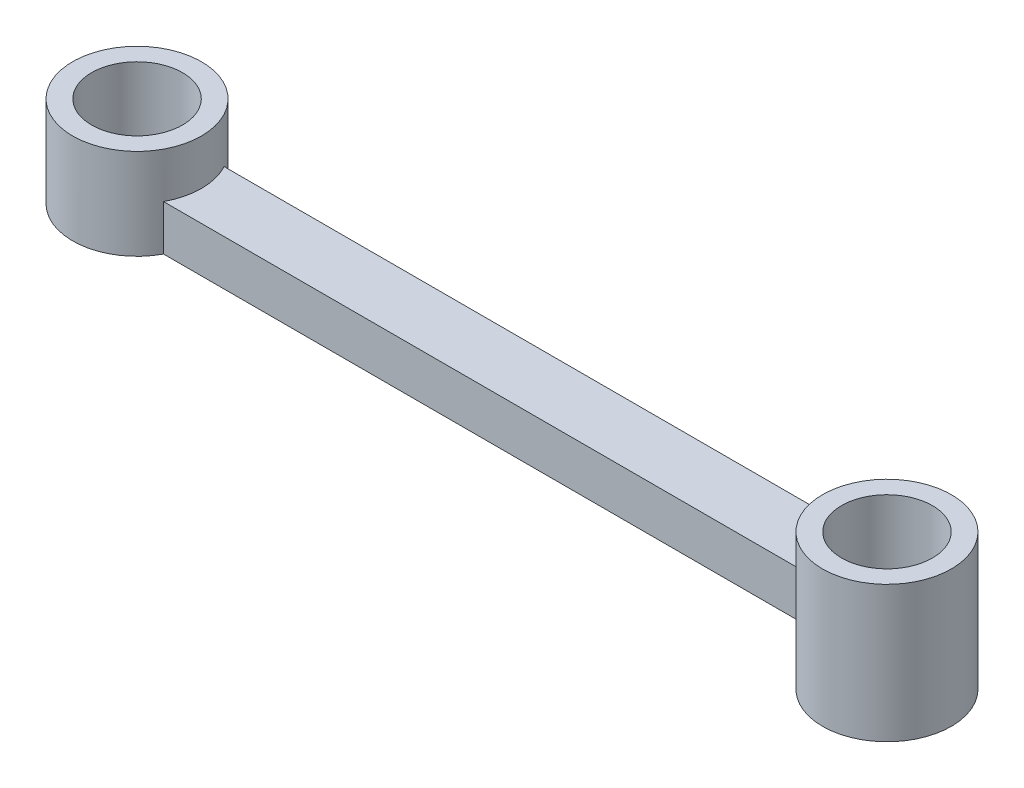
from build123d import *

# Parameters (mm, degrees)
BOSS_EXTRUDE1_DEPTH      = 3
SKETCH2_3_R              = 3
BOSS_EXTRUDE2_DEPTH      = 6
BOSS_EXTRUDE3_DEPTH      = 6
BOSS_EXTRUDE3_DEPTH_BACK = 3
SKETCH2_4_R              = 3


with BuildPart() as part:
    # Sketch2 → Boss-Extrude1 (new body)
    with BuildSketch(Plane(origin=(0, 0, 0), x_dir=(1, 0, 0), z_dir=(0, 1, 0))):
        with BuildLine():
            ThreePointArc((21, -2), (20.5, 0), (21, 2))
            Line((21, 2), (-21, 2))
            ThreePointArc((-21, 2), (-20.626894374, 1.030776406), (-20.5, 0))
            ThreePointArc((-20.5, 0), (-20.626894374, -1.030776406), (-21, -2))
            Line((-21, -2), (21, -2))
        make_face()
    extrude(amount=BOSS_EXTRUDE1_DEPTH)

    # Sketch2<3> → Boss-Extrude2 (add)
    with BuildSketch(Plane(origin=(0, 0, 0), x_dir=(1, 0, 0), z_dir=(0, 1, 0))):
        with BuildLine():
            ThreePointArc((-20.5, 0), (-20.626894374, 1.030776406), (-21, 2))
            ThreePointArc((-21, 2), (-29, 0), (-21, -2))
            ThreePointArc((-21, -2), (-20.626894374, -1.030776406), (-20.5, 0))
        make_face()
        with Locations((-24.75, 0)):
            Circle(SKETCH2_3_R, mode=Mode.SUBTRACT)
    extrude(amount=BOSS_EXTRUDE2_DEPTH)

    # Sketch2<4> → Boss-Extrude3 (add, two sides: drawn at the far end of the back side and taken through both)
    with BuildSketch(Plane(origin=(0, 0, 0), x_dir=(1, 0, 0), z_dir=(0, 1, 0)).offset(-BOSS_EXTRUDE3_DEPTH_BACK)):
        with BuildLine():
            ThreePointArc((29, 0), (25.780776406, 4.123105626), (21, 2))
            ThreePointArc((21, 2), (20.5, 0), (21, -2))
            ThreePointArc((21, -2), (25.780776406, -4.123105626), (29, 0))
        make_face()
        with Locations((24.75, 0)):
            Circle(SKETCH2_4_R, mode=Mode.SUBTRACT)
    extrude(amount=BOSS_EXTRUDE3_DEPTH + BOSS_EXTRUDE3_DEPTH_BACK)


solid = part.part
